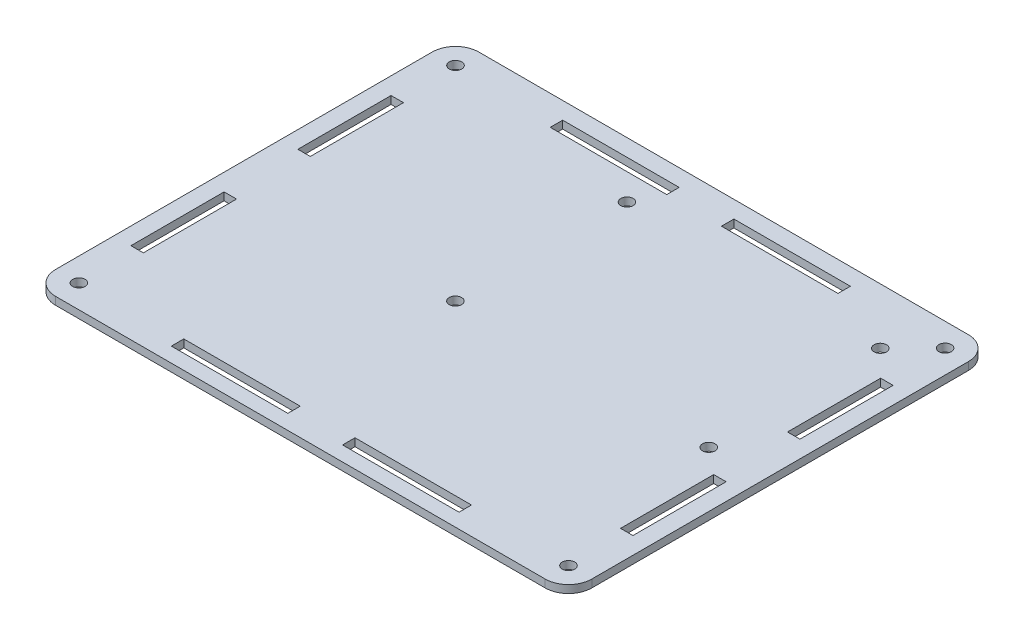
from build123d import *

# Parameters (mm, degrees)
SKETCH1_W           = 138.1
SKETCH1_H           = 109
SKETCH1_R           = 1.6
SKETCH1_W_2         = 30
SKETCH1_H_2         = 3.2
SKETCH1_W_3         = 3.2
SKETCH1_H_3         = 24
BOSS_EXTRUDE1_DEPTH = 2
FILLET1_R           = 6
FILLET2_R           = 6
FILLET3_R           = 6


with BuildPart() as part:
    # Sketch1 → Boss-Extrude1 (new body)
    with BuildSketch(Plane(origin=(0, 0, 0), x_dir=(1, 0, 0), z_dir=(0, 1, 0))):
        with Locations((69.05, 54.5)):
            Rectangle(SKETCH1_W, SKETCH1_H)
        with Locations(Location((58.541, 94.62, 0), (0, 0, 270))):
            Circle(SKETCH1_R, mode=Mode.SUBTRACT)
        with Locations(Location((123.794, 94.62, 0), (0, 0, 270))):
            Circle(SKETCH1_R, mode=Mode.SUBTRACT)
        with Locations(Location((123.794, 50.439, 0), (0, 0, 270))):
            Circle(SKETCH1_R, mode=Mode.SUBTRACT)
        with Locations(Location((58.541, 50.44, 0), (0, 0, 270))):
            Circle(SKETCH1_R, mode=Mode.SUBTRACT)
        with Locations(Location((6, 103, 0), (0, 0, 270))):
            Circle(SKETCH1_R, mode=Mode.SUBTRACT)
        with Locations(Location((132.1, 103, 0), (0, 0, 270))):
            Circle(SKETCH1_R, mode=Mode.SUBTRACT)
        with Locations(Location((132.1, 6, 0), (0, 0, 270))):
            Circle(SKETCH1_R, mode=Mode.SUBTRACT)
        with Locations(Location((6, 6, 0), (0, 0, 270))):
            Circle(SKETCH1_R, mode=Mode.SUBTRACT)
        with Locations((47, 5.414130674)):
            Rectangle(SKETCH1_W_2, SKETCH1_H_2, mode=Mode.SUBTRACT)
        with Locations((47, 103)):
            Rectangle(SKETCH1_W_2, SKETCH1_H_2, mode=Mode.SUBTRACT)
        with Locations((91.1, 103)):
            Rectangle(SKETCH1_W_2, SKETCH1_H_2, mode=Mode.SUBTRACT)
        with Locations((91.1, 5.414130674)):
            Rectangle(SKETCH1_W_2, SKETCH1_H_2, mode=Mode.SUBTRACT)
        with Locations((6, 76)):
            Rectangle(SKETCH1_W_3, SKETCH1_H_3, mode=Mode.SUBTRACT)
        with Locations((6, 33)):
            Rectangle(SKETCH1_W_3, SKETCH1_H_3, mode=Mode.SUBTRACT)
        with Locations((132.1, 76)):
            Rectangle(SKETCH1_W_3, SKETCH1_H_3, mode=Mode.SUBTRACT)
        with Locations((132.1, 33)):
            Rectangle(SKETCH1_W_3, SKETCH1_H_3, mode=Mode.SUBTRACT)
    extrude(amount=BOSS_EXTRUDE1_DEPTH)

    # Fillet1
    fillet1_edges = [part.edges().sort_by_distance(p)[0] for p in [
        (0, 1, -109),
    ]]
    fillet(fillet1_edges, radius=FILLET1_R)

    # Fillet2
    fillet2_edges = [part.edges().sort_by_distance(p)[0] for p in [
        (0, 1, 0),
    ]]
    fillet(fillet2_edges, radius=FILLET2_R)

    # Fillet3
    fillet3_edges = [part.edges().sort_by_distance(p)[0] for p in [
        (138.1, 1, -109),
        (138.1, 1, 0),
    ]]
    fillet(fillet3_edges, radius=FILLET3_R)


solid = part.part
